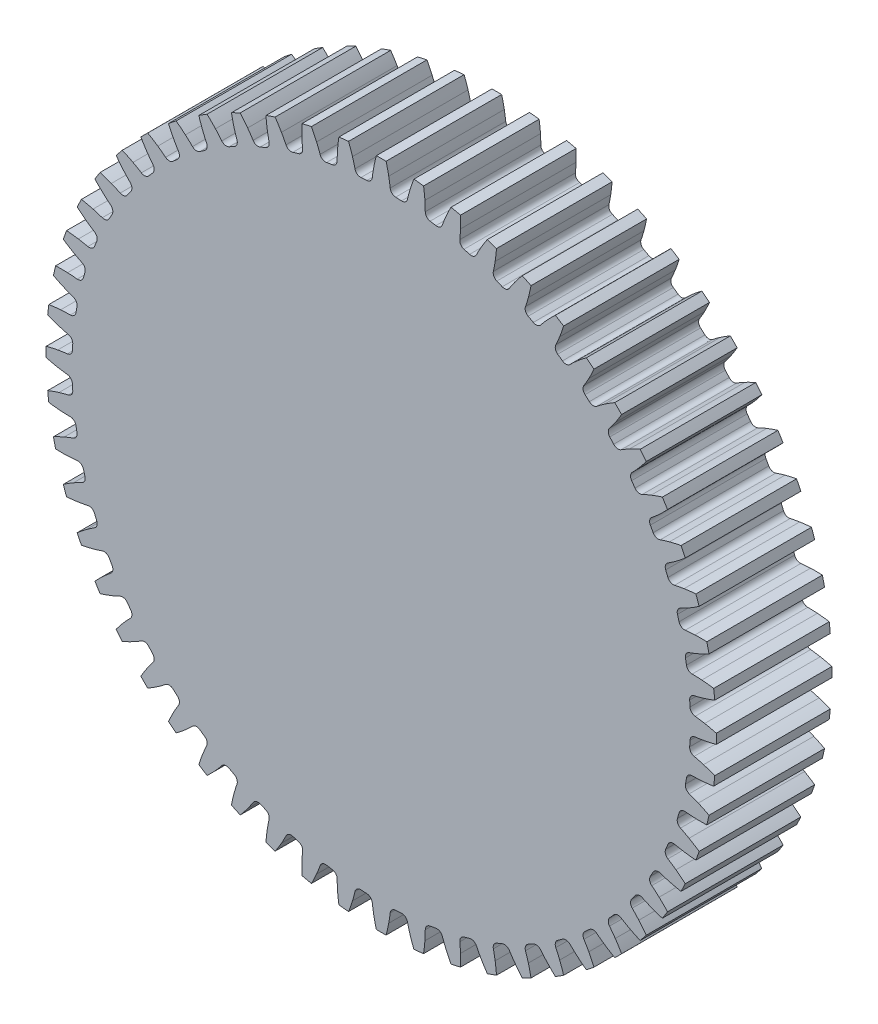
from build123d import *

# Parameters (mm, degrees)
BOSS_EXTRUDE1_DEPTH = 50


with BuildPart() as part:
    # Sketch1 → Boss-Extrude1 (new body)
    with BuildSketch(Plane.XY):
        with BuildLine():
            ThreePointArc((-6.237316061, 133.604484911), (-7.499422318, 133.539586509), (-8.760859031, 133.462765778))
            ThreePointArc((-8.760859031, 133.462765778), (-10.418270981, 133.952655771), (-11.361832531, 135.400653761))
            ThreePointArc((-11.361832531, 135.400653761), (-11.864955386, 137.433138507), (-12.441237743, 139.446102862))
            ThreePointArc((-12.441237743, 139.446102862), (-13.244705793, 141.894408075), (-14.146350673, 144.308283763))
            ThreePointArc((-14.146350673, 144.308283763), (-16.234849035, 144.088270435), (-18.319941954, 143.838032963))
            ThreePointArc((-18.319941954, 143.838032963), (-18.661842842, 141.284043318), (-18.900367108, 138.718333767))
            ThreePointArc((-18.900367108, 138.718333767), (-19.014274155, 136.627603743), (-19.052512266, 134.534122266))
            ThreePointArc((-19.052512266, 134.534122266), (-19.650206892, 132.912466411), (-21.157053285, 132.066050128))
            ThreePointArc((-21.157053285, 132.066050128), (-22.403957367, 131.860248727), (-23.648861238, 131.642674928))
            ThreePointArc((-23.648861238, 131.642674928), (-25.350702006, 131.943913335), (-26.450454975, 133.277161243))
            ThreePointArc((-26.450454975, 133.277161243), (-27.177980389, 135.240534265), (-27.976019703, 137.17631837))
            ThreePointArc((-27.976019703, 137.17631837), (-29.048558925, 139.519269275), (-30.214802778, 141.817014822))
            ThreePointArc((-30.214802778, 141.817014822), (-32.265535424, 141.364547266), (-34.309500009, 140.8824269))
            ThreePointArc((-34.309500009, 140.8824269), (-34.363294983, 138.306215452), (-34.313051132, 135.729932299))
            ThreePointArc((-34.313051132, 135.729932299), (-34.192154464, 133.639594804), (-33.995756585, 131.554995388))
            ThreePointArc((-33.995756585, 131.554995388), (-34.408125185, 129.8766156), (-35.810728288, 128.866808137))
            ThreePointArc((-35.810728288, 128.866808137), (-37.026749653, 128.52269181), (-38.239465294, 128.16710106))
            ThreePointArc((-38.239465294, 128.16710106), (-39.964333244, 128.275899633), (-41.206447601, 129.477631093))
            ThreePointArc((-41.206447601, 129.477631093), (-42.149226519, 131.347201836), (-43.158986983, 133.181462083))
            ThreePointArc((-43.158986983, 133.181462083), (-44.487109575, 135.389594712), (-45.903286207, 137.542314636))
            ThreePointArc((-45.903286207, 137.542314636), (-47.890463983, 136.863082895), (-49.867596194, 136.155142576))
            ThreePointArc((-49.867596194, 136.155142576), (-49.632608751, 133.589106678), (-49.29422863, 131.03464818))
            ThreePointArc((-49.29422863, 131.03464818), (-48.940048593, 128.97099042), (-48.511484541, 126.921488114))
            ThreePointArc((-48.511484541, 126.921488114), (-48.73334134, 125.207490991), (-50.014062605, 124.046991264))
            ThreePointArc((-50.014062605, 124.046991264), (-51.183909079, 123.568887473), (-52.349185886, 123.079751532))
            ThreePointArc((-52.349185886, 123.079751532), (-54.075389804, 122.994742066), (-55.44424524, 124.049844608))
            ThreePointArc((-55.44424524, 124.049844608), (-56.590421671, 125.802102134), (-57.799204961, 127.511771637))
            ThreePointArc((-57.799204961, 127.511771637), (-59.366209009, 129.557317441), (-61.014509178, 131.537940039))
            ThreePointArc((-61.014509178, 131.537940039), (-62.913142172, 130.640485846), (-64.798578423, 129.715628335))
            ThreePointArc((-64.798578423, 129.715628335), (-64.277763667, 127.192037379), (-63.655502602, 124.691527332))
            ThreePointArc((-63.655502602, 124.691527332), (-63.072493214, 122.680501002), (-62.417152431, 120.691869485))
            ThreePointArc((-62.417152431, 120.691869485), (-62.445707451, 118.963809536), (-63.588441066, 117.667211502))
            ThreePointArc((-63.588441066, 117.667211502), (-64.69740115, 117.06113268), (-65.800585092, 116.444602715))
            ThreePointArc((-65.800585092, 116.444602715), (-67.506416962, 116.166854254), (-68.984799325, 117.062059351))
            ThreePointArc((-68.984799325, 117.062059351), (-70.319959436, 118.674968006), (-71.7125644, 120.238546678))
            ThreePointArc((-71.7125644, 120.238546678), (-73.49874392, 122.095781732), (-75.358439295, 123.879399526))
            ThreePointArc((-75.358439295, 123.879399526), (-77.144651095, 122.775008888), (-78.914680932, 121.644864805))
            ThreePointArc((-78.914680932, 121.644864805), (-78.114588411, 119.19545441), (-77.216271695, 116.78033818))
            ThreePointArc((-77.216271695, 116.78033818), (-76.411764638, 114.847233102), (-75.537888414, 112.944480571))
            ThreePointArc((-75.537888414, 112.944480571), (-75.37278256, 111.224089152), (-76.363157986, 109.807698284))
            ThreePointArc((-76.363157986, 109.807698284), (-77.397285864, 109.081266223), (-78.424503762, 108.345095457))
            ThreePointArc((-78.424503762, 108.345095457), (-80.088511758, 107.878100849), (-81.657829533, 108.602150777))
            ThreePointArc((-81.657829533, 108.602150777), (-83.16518291, 110.055427298), (-84.724096733, 111.45325223))
            ThreePointArc((-84.724096733, 111.45325223), (-86.706989481, 113.098820726), (-88.754693314, 114.663003688))
            ThreePointArc((-88.754693314, 114.663003688), (-90.40602127, 113.365564958), (-92.038385541, 112.04434652))
            ThreePointArc((-92.038385541, 112.04434652), (-90.969076881, 109.699919444), (-89.806001369, 107.400568518))
            ThreePointArc((-89.806001369, 107.400568518), (-88.790113786, 105.56969461), (-87.708691623, 103.776749281))
            ThreePointArc((-87.708691623, 103.776749281), (-87.352001195, 102.085661313), (-88.177563887, 100.567289547))
            ThreePointArc((-88.177563887, 100.567289547), (-89.123854801, 99.729639553), (-90.062188794, 98.883085761))
            ThreePointArc((-90.062188794, 98.883085761), (-91.663447051, 98.232717733), (-93.303965156, 98.776507144))
            ThreePointArc((-93.303965156, 98.776507144), (-94.964555955, 100.051875737), (-96.670174392, 101.26636847))
            ThreePointArc((-96.670174392, 101.26636847), (-98.824844341, 102.679576429), (-101.034805568, 104.004654049))
            ThreePointArc((-101.034805568, 104.004654049), (-102.530483272, 102.530483272), (-104.004654049, 101.034805568))
            ThreePointArc((-104.004654049, 101.034805568), (-102.679576429, 98.824844341), (-101.26636847, 96.670174392))
            ThreePointArc((-101.26636847, 96.670174392), (-100.051875737, 94.964555955), (-98.776507144, 93.303965156))
            ThreePointArc((-98.776507144, 93.303965156), (-98.232717733, 91.663447051), (-98.883085761, 90.062188794))
            ThreePointArc((-98.883085761, 90.062188794), (-99.729639553, 89.123854801), (-100.567289547, 88.177563887))
            ThreePointArc((-100.567289547, 88.177563887), (-102.085661313, 87.352001195), (-103.776749281, 87.708691623))
            ThreePointArc((-103.776749281, 87.708691623), (-105.56969461, 88.790113786), (-107.400568518, 89.806001369))
            ThreePointArc((-107.400568518, 89.806001369), (-109.699919444, 90.969076881), (-112.04434652, 92.038385541))
            ThreePointArc((-112.04434652, 92.038385541), (-113.365564958, 90.40602127), (-114.663003688, 88.754693314))
            ThreePointArc((-114.663003688, 88.754693314), (-113.098820726, 86.706989481), (-111.45325223, 84.724096733))
            ThreePointArc((-111.45325223, 84.724096733), (-110.055427298, 83.16518291), (-108.602150777, 81.657829533))
            ThreePointArc((-108.602150777, 81.657829533), (-107.878100849, 80.088511758), (-108.345095457, 78.424503762))
            ThreePointArc((-108.345095457, 78.424503762), (-109.081266223, 77.397285864), (-109.807698284, 76.363157986))
            ThreePointArc((-109.807698284, 76.363157986), (-111.224089152, 75.37278256), (-112.944480571, 75.537888414))
            ThreePointArc((-112.944480571, 75.537888414), (-114.847233102, 76.411764638), (-116.78033818, 77.216271695))
            ThreePointArc((-116.78033818, 77.216271695), (-119.19545441, 78.114588411), (-121.644864805, 78.914680932))
            ThreePointArc((-121.644864805, 78.914680932), (-122.775008888, 77.144651095), (-123.879399526, 75.358439295))
            ThreePointArc((-123.879399526, 75.358439295), (-122.095781732, 73.49874392), (-120.238546678, 71.7125644))
            ThreePointArc((-120.238546678, 71.7125644), (-118.674968006, 70.319959436), (-117.062059351, 68.984799325))
            ThreePointArc((-117.062059351, 68.984799325), (-116.166854254, 67.506416962), (-116.444602715, 65.800585092))
            ThreePointArc((-116.444602715, 65.800585092), (-117.06113268, 64.69740115), (-117.667211502, 63.588441066))
            ThreePointArc((-117.667211502, 63.588441066), (-118.963809536, 62.445707451), (-120.691869485, 62.417152431))
            ThreePointArc((-120.691869485, 62.417152431), (-122.680501001, 63.072493214), (-124.691527332, 63.655502602))
            ThreePointArc((-124.691527332, 63.655502602), (-127.192037379, 64.277763667), (-129.715628335, 64.798578423))
            ThreePointArc((-129.715628335, 64.798578423), (-130.640485846, 62.913142172), (-131.537940039, 61.014509178))
            ThreePointArc((-131.537940039, 61.014509178), (-129.557317441, 59.366209009), (-127.511771637, 57.799204961))
            ThreePointArc((-127.511771637, 57.799204961), (-125.802102134, 56.590421671), (-124.049844608, 55.44424524))
            ThreePointArc((-124.049844608, 55.44424524), (-122.994742066, 54.075389804), (-123.079751532, 52.349185886))
            ThreePointArc((-123.079751532, 52.349185886), (-123.568887473, 51.183909079), (-124.046991264, 50.014062605))
            ThreePointArc((-124.046991264, 50.014062605), (-125.207490991, 48.73334134), (-126.921488114, 48.511484541))
            ThreePointArc((-126.921488114, 48.511484541), (-128.97099042, 48.940048593), (-131.03464818, 49.29422863))
            ThreePointArc((-131.03464818, 49.29422863), (-133.589106678, 49.632608751), (-136.155142576, 49.867596194))
            ThreePointArc((-136.155142576, 49.867596194), (-136.863082895, 47.890463984), (-137.542314636, 45.903286207))
            ThreePointArc((-137.542314636, 45.903286207), (-135.389594712, 44.487109575), (-133.181462083, 43.158986983))
            ThreePointArc((-133.181462083, 43.158986983), (-131.347201836, 42.149226519), (-129.477631093, 41.206447601))
            ThreePointArc((-129.477631093, 41.206447601), (-128.275899633, 39.964333244), (-128.16710106, 38.239465294))
            ThreePointArc((-128.16710106, 38.239465294), (-128.52269181, 37.026749653), (-128.866808137, 35.810728288))
            ThreePointArc((-128.866808137, 35.810728288), (-129.8766156, 34.408125185), (-131.554995388, 33.995756585))
            ThreePointArc((-131.554995388, 33.995756585), (-133.639594804, 34.192154464), (-135.729932299, 34.313051132))
            ThreePointArc((-135.729932299, 34.313051132), (-138.306215452, 34.363294983), (-140.8824269, 34.309500009))
            ThreePointArc((-140.8824269, 34.309500009), (-141.364547266, 32.265535424), (-141.817014822, 30.214802778))
            ThreePointArc((-141.817014822, 30.214802778), (-139.519269275, 29.048558925), (-137.17631837, 27.976019703))
            ThreePointArc((-137.17631837, 27.976019703), (-135.240534265, 27.177980389), (-133.277161243, 26.450454975))
            ThreePointArc((-133.277161243, 26.450454975), (-131.943913335, 25.350702006), (-131.642674928, 23.648861238))
            ThreePointArc((-131.642674928, 23.648861238), (-131.860248727, 22.403957367), (-132.066050128, 21.157053285))
            ThreePointArc((-132.066050128, 21.157053285), (-132.912466411, 19.650206892), (-134.534122266, 19.052512266))
            ThreePointArc((-134.534122266, 19.052512266), (-136.627603743, 19.014274155), (-138.718333767, 18.900367108))
            ThreePointArc((-138.718333767, 18.900367108), (-141.284043318, 18.661842842), (-143.838032963, 18.319941954))
            ThreePointArc((-143.838032963, 18.319941954), (-144.088270435, 16.234849035), (-144.308283763, 14.146350673))
            ThreePointArc((-144.308283763, 14.146350673), (-141.894408075, 13.244705793), (-139.446102862, 12.441237743))
            ThreePointArc((-139.446102862, 12.441237743), (-137.433138507, 11.864955386), (-135.400653761, 11.361832531))
            ThreePointArc((-135.400653761, 11.361832531), (-133.952655771, 10.418270981), (-133.462765778, 8.760859031))
            ThreePointArc((-133.462765778, 8.760859031), (-133.539586509, 7.499422318), (-133.604484911, 6.237316061))
            ThreePointArc((-133.604484911, 6.237316061), (-134.27686584, 4.645175846), (-135.821404497, 3.86967155))
            ThreePointArc((-135.821404497, 3.86967155), (-137.897441292, 3.597278316), (-139.962271702, 3.25))
            ThreePointArc((-139.962271702, 3.25), (-142.485142365, 2.725707199), (-144.984792306, 2.1))
            ThreePointArc((-144.984792306, 2.1), (-145, 0), (-144.984792306, -2.1))
            ThreePointArc((-144.984792306, -2.1), (-142.485142365, -2.725707199), (-139.962271702, -3.25))
            ThreePointArc((-139.962271702, -3.25), (-137.897441292, -3.597278316), (-135.821404497, -3.86967155))
            ThreePointArc((-135.821404497, -3.86967155), (-134.27686584, -4.645175846), (-133.604484911, -6.237316061))
            ThreePointArc((-133.604484911, -6.237316061), (-133.539586509, -7.499422318), (-133.462765778, -8.760859031))
            ThreePointArc((-133.462765778, -8.760859031), (-133.952655771, -10.418270981), (-135.400653761, -11.361832531))
            ThreePointArc((-135.400653761, -11.361832531), (-137.433138507, -11.864955386), (-139.446102862, -12.441237743))
            ThreePointArc((-139.446102862, -12.441237743), (-141.894408075, -13.244705793), (-144.308283763, -14.146350673))
            ThreePointArc((-144.308283763, -14.146350673), (-144.088270435, -16.234849035), (-143.838032963, -18.319941954))
            ThreePointArc((-143.838032963, -18.319941954), (-141.284043318, -18.661842842), (-138.718333767, -18.900367108))
            ThreePointArc((-138.718333767, -18.900367108), (-136.627603743, -19.014274155), (-134.534122266, -19.052512266))
            ThreePointArc((-134.534122266, -19.052512266), (-132.912466411, -19.650206892), (-132.066050128, -21.157053285))
            ThreePointArc((-132.066050128, -21.157053285), (-131.860248727, -22.403957367), (-131.642674928, -23.648861238))
            ThreePointArc((-131.642674928, -23.648861238), (-131.943913335, -25.350702006), (-133.277161243, -26.450454975))
            ThreePointArc((-133.277161243, -26.450454975), (-135.240534265, -27.177980389), (-137.17631837, -27.976019703))
            ThreePointArc((-137.17631837, -27.976019703), (-139.519269275, -29.048558925), (-141.817014822, -30.214802778))
            ThreePointArc((-141.817014822, -30.214802778), (-141.364547266, -32.265535424), (-140.8824269, -34.309500009))
            ThreePointArc((-140.8824269, -34.309500009), (-138.306215452, -34.363294983), (-135.729932299, -34.313051132))
            ThreePointArc((-135.729932299, -34.313051132), (-133.639594804, -34.192154464), (-131.554995388, -33.995756585))
            ThreePointArc((-131.554995388, -33.995756585), (-129.8766156, -34.408125185), (-128.866808137, -35.810728288))
            ThreePointArc((-128.866808137, -35.810728288), (-128.52269181, -37.026749653), (-128.16710106, -38.239465294))
            ThreePointArc((-128.16710106, -38.239465294), (-128.275899633, -39.964333244), (-129.477631093, -41.206447601))
            ThreePointArc((-129.477631093, -41.206447601), (-131.347201836, -42.149226519), (-133.181462083, -43.158986983))
            ThreePointArc((-133.181462083, -43.158986983), (-135.389594712, -44.487109575), (-137.542314636, -45.903286207))
            ThreePointArc((-137.542314636, -45.903286207), (-136.863082895, -47.890463983), (-136.155142576, -49.867596194))
            ThreePointArc((-136.155142576, -49.867596194), (-133.589106678, -49.632608751), (-131.03464818, -49.29422863))
            ThreePointArc((-131.03464818, -49.29422863), (-128.97099042, -48.940048593), (-126.921488114, -48.511484541))
            ThreePointArc((-126.921488114, -48.511484541), (-125.207490991, -48.73334134), (-124.046991264, -50.014062605))
            ThreePointArc((-124.046991264, -50.014062605), (-123.568887473, -51.183909079), (-123.079751532, -52.349185886))
            ThreePointArc((-123.079751532, -52.349185886), (-122.994742066, -54.075389804), (-124.049844608, -55.44424524))
            ThreePointArc((-124.049844608, -55.44424524), (-125.802102134, -56.590421671), (-127.511771637, -57.799204961))
            ThreePointArc((-127.511771637, -57.799204961), (-129.557317441, -59.366209009), (-131.537940039, -61.014509178))
            ThreePointArc((-131.537940039, -61.014509178), (-130.640485846, -62.913142172), (-129.715628335, -64.798578423))
            ThreePointArc((-129.715628335, -64.798578423), (-127.192037379, -64.277763667), (-124.691527332, -63.655502602))
            ThreePointArc((-124.691527332, -63.655502602), (-122.680501002, -63.072493214), (-120.691869485, -62.417152431))
            ThreePointArc((-120.691869485, -62.417152431), (-118.963809536, -62.445707451), (-117.667211502, -63.588441066))
            ThreePointArc((-117.667211502, -63.588441066), (-117.06113268, -64.69740115), (-116.444602715, -65.800585092))
            ThreePointArc((-116.444602715, -65.800585092), (-116.166854254, -67.506416962), (-117.062059351, -68.984799325))
            ThreePointArc((-117.062059351, -68.984799325), (-118.674968006, -70.319959436), (-120.238546678, -71.7125644))
            ThreePointArc((-120.238546678, -71.7125644), (-122.095781732, -73.49874392), (-123.879399526, -75.358439295))
            ThreePointArc((-123.879399526, -75.358439295), (-122.775008888, -77.144651095), (-121.644864805, -78.914680932))
            ThreePointArc((-121.644864805, -78.914680932), (-119.19545441, -78.114588411), (-116.78033818, -77.216271695))
            ThreePointArc((-116.78033818, -77.216271695), (-114.847233102, -76.411764638), (-112.944480571, -75.537888414))
            ThreePointArc((-112.944480571, -75.537888414), (-111.224089152, -75.37278256), (-109.807698284, -76.363157986))
            ThreePointArc((-109.807698284, -76.363157986), (-109.081266223, -77.397285864), (-108.345095457, -78.424503762))
            ThreePointArc((-108.345095457, -78.424503762), (-107.878100849, -80.088511758), (-108.602150777, -81.657829533))
            ThreePointArc((-108.602150777, -81.657829533), (-110.055427298, -83.16518291), (-111.45325223, -84.724096733))
            ThreePointArc((-111.45325223, -84.724096733), (-113.098820726, -86.706989481), (-114.663003688, -88.754693314))
            ThreePointArc((-114.663003688, -88.754693314), (-113.365564958, -90.40602127), (-112.04434652, -92.038385541))
            ThreePointArc((-112.04434652, -92.038385541), (-109.699919444, -90.969076881), (-107.400568518, -89.806001369))
            ThreePointArc((-107.400568518, -89.806001369), (-105.56969461, -88.790113786), (-103.776749281, -87.708691623))
            ThreePointArc((-103.776749281, -87.708691623), (-102.085661313, -87.352001195), (-100.567289547, -88.177563887))
            ThreePointArc((-100.567289547, -88.177563887), (-99.729639553, -89.123854801), (-98.883085761, -90.062188794))
            ThreePointArc((-98.883085761, -90.062188794), (-98.232717733, -91.663447051), (-98.776507144, -93.303965156))
            ThreePointArc((-98.776507144, -93.303965156), (-100.051875737, -94.964555955), (-101.26636847, -96.670174392))
            ThreePointArc((-101.26636847, -96.670174392), (-102.679576429, -98.824844341), (-104.004654049, -101.034805568))
            ThreePointArc((-104.004654049, -101.034805568), (-102.530483272, -102.530483272), (-101.034805568, -104.004654049))
            ThreePointArc((-101.034805568, -104.004654049), (-98.824844341, -102.679576429), (-96.670174392, -101.26636847))
            ThreePointArc((-96.670174392, -101.26636847), (-94.964555955, -100.051875737), (-93.303965156, -98.776507144))
            ThreePointArc((-93.303965156, -98.776507144), (-91.663447051, -98.232717733), (-90.062188794, -98.883085761))
            ThreePointArc((-90.062188794, -98.883085761), (-89.123854801, -99.729639553), (-88.177563887, -100.567289547))
            ThreePointArc((-88.177563887, -100.567289547), (-87.352001195, -102.085661313), (-87.708691623, -103.776749281))
            ThreePointArc((-87.708691623, -103.776749281), (-88.790113786, -105.56969461), (-89.806001369, -107.400568518))
            ThreePointArc((-89.806001369, -107.400568518), (-90.969076881, -109.699919444), (-92.038385541, -112.04434652))
            ThreePointArc((-92.038385541, -112.04434652), (-90.40602127, -113.365564958), (-88.754693314, -114.663003688))
            ThreePointArc((-88.754693314, -114.663003688), (-86.706989481, -113.098820726), (-84.724096733, -111.45325223))
            ThreePointArc((-84.724096733, -111.45325223), (-83.16518291, -110.055427298), (-81.657829533, -108.602150777))
            ThreePointArc((-81.657829533, -108.602150777), (-80.088511758, -107.878100849), (-78.424503762, -108.345095457))
            ThreePointArc((-78.424503762, -108.345095457), (-77.397285864, -109.081266223), (-76.363157986, -109.807698284))
            ThreePointArc((-76.363157986, -109.807698284), (-75.37278256, -111.224089152), (-75.537888414, -112.944480571))
            ThreePointArc((-75.537888414, -112.944480571), (-76.411764638, -114.847233102), (-77.216271695, -116.78033818))
            ThreePointArc((-77.216271695, -116.78033818), (-78.114588411, -119.19545441), (-78.914680932, -121.644864805))
            ThreePointArc((-78.914680932, -121.644864805), (-77.144651095, -122.775008888), (-75.358439295, -123.879399526))
            ThreePointArc((-75.358439295, -123.879399526), (-73.49874392, -122.095781732), (-71.7125644, -120.238546678))
            ThreePointArc((-71.7125644, -120.238546678), (-70.319959436, -118.674968006), (-68.984799325, -117.062059351))
            ThreePointArc((-68.984799325, -117.062059351), (-67.506416962, -116.166854254), (-65.800585092, -116.444602715))
            ThreePointArc((-65.800585092, -116.444602715), (-64.69740115, -117.06113268), (-63.588441066, -117.667211502))
            ThreePointArc((-63.588441066, -117.667211502), (-62.445707451, -118.963809536), (-62.417152431, -120.691869485))
            ThreePointArc((-62.417152431, -120.691869485), (-63.072493214, -122.680501002), (-63.655502602, -124.691527332))
            ThreePointArc((-63.655502602, -124.691527332), (-64.277763667, -127.192037379), (-64.798578423, -129.715628335))
            ThreePointArc((-64.798578423, -129.715628335), (-62.913142172, -130.640485846), (-61.014509178, -131.537940039))
            ThreePointArc((-61.014509178, -131.537940039), (-59.366209009, -129.557317441), (-57.799204961, -127.511771637))
            ThreePointArc((-57.799204961, -127.511771637), (-56.590421671, -125.802102134), (-55.44424524, -124.049844608))
            ThreePointArc((-55.44424524, -124.049844608), (-54.075389804, -122.994742066), (-52.349185886, -123.079751532))
            ThreePointArc((-52.349185886, -123.079751532), (-51.183909079, -123.568887473), (-50.014062605, -124.046991264))
            ThreePointArc((-50.014062605, -124.046991264), (-48.73334134, -125.207490991), (-48.511484541, -126.921488114))
            ThreePointArc((-48.511484541, -126.921488114), (-48.940048593, -128.97099042), (-49.29422863, -131.03464818))
            ThreePointArc((-49.29422863, -131.03464818), (-49.632608751, -133.589106678), (-49.867596194, -136.155142576))
            ThreePointArc((-49.867596194, -136.155142576), (-47.890463984, -136.863082895), (-45.903286207, -137.542314636))
            ThreePointArc((-45.903286207, -137.542314636), (-44.487109575, -135.389594712), (-43.158986983, -133.181462083))
            ThreePointArc((-43.158986983, -133.181462083), (-42.149226519, -131.347201836), (-41.206447601, -129.477631093))
            ThreePointArc((-41.206447601, -129.477631093), (-39.964333244, -128.275899633), (-38.239465294, -128.16710106))
            ThreePointArc((-38.239465294, -128.16710106), (-37.026749653, -128.52269181), (-35.810728288, -128.866808137))
            ThreePointArc((-35.810728288, -128.866808137), (-34.408125185, -129.8766156), (-33.995756585, -131.554995388))
            ThreePointArc((-33.995756585, -131.554995388), (-34.192154464, -133.639594804), (-34.313051132, -135.729932299))
            ThreePointArc((-34.313051132, -135.729932299), (-34.363294983, -138.306215452), (-34.309500009, -140.8824269))
            ThreePointArc((-34.309500009, -140.8824269), (-32.265535424, -141.364547266), (-30.214802778, -141.817014822))
            ThreePointArc((-30.214802778, -141.817014822), (-29.048558925, -139.519269275), (-27.976019703, -137.17631837))
            ThreePointArc((-27.976019703, -137.17631837), (-27.177980389, -135.240534265), (-26.450454975, -133.277161243))
            ThreePointArc((-26.450454975, -133.277161243), (-25.350702006, -131.943913335), (-23.648861238, -131.642674928))
            ThreePointArc((-23.648861238, -131.642674928), (-22.403957367, -131.860248727), (-21.157053285, -132.066050128))
            ThreePointArc((-21.157053285, -132.066050128), (-19.650206892, -132.912466411), (-19.052512266, -134.534122266))
            ThreePointArc((-19.052512266, -134.534122266), (-19.014274155, -136.627603743), (-18.900367108, -138.718333767))
            ThreePointArc((-18.900367108, -138.718333767), (-18.661842842, -141.284043318), (-18.319941954, -143.838032963))
            ThreePointArc((-18.319941954, -143.838032963), (-16.234849035, -144.088270435), (-14.146350673, -144.308283763))
            ThreePointArc((-14.146350673, -144.308283763), (-13.244705793, -141.894408075), (-12.441237743, -139.446102862))
            ThreePointArc((-12.441237743, -139.446102862), (-11.864955386, -137.433138507), (-11.361832531, -135.400653761))
            ThreePointArc((-11.361832531, -135.400653761), (-10.418270981, -133.952655771), (-8.760859031, -133.462765778))
            ThreePointArc((-8.760859031, -133.462765778), (-7.499422318, -133.539586509), (-6.237316061, -133.604484911))
            ThreePointArc((-6.237316061, -133.604484911), (-4.645175846, -134.27686584), (-3.86967155, -135.821404497))
            ThreePointArc((-3.86967155, -135.821404497), (-3.597278316, -137.897441292), (-3.25, -139.962271702))
            ThreePointArc((-3.25, -139.962271702), (-2.725707199, -142.485142365), (-2.1, -144.984792306))
            ThreePointArc((-2.1, -144.984792306), (0, -145), (2.1, -144.984792306))
            ThreePointArc((2.1, -144.984792306), (2.725707199, -142.485142365), (3.25, -139.962271702))
            ThreePointArc((3.25, -139.962271702), (3.597278316, -137.897441292), (3.86967155, -135.821404497))
            ThreePointArc((3.86967155, -135.821404497), (4.645175846, -134.27686584), (6.237316061, -133.604484911))
            ThreePointArc((6.237316061, -133.604484911), (7.499422318, -133.539586509), (8.760859031, -133.462765778))
            ThreePointArc((8.760859031, -133.462765778), (10.418270981, -133.952655771), (11.361832531, -135.400653761))
            ThreePointArc((11.361832531, -135.400653761), (11.864955386, -137.433138507), (12.441237743, -139.446102862))
            ThreePointArc((12.441237743, -139.446102862), (13.244705793, -141.894408075), (14.146350673, -144.308283763))
            ThreePointArc((14.146350673, -144.308283763), (16.234849035, -144.088270435), (18.319941954, -143.838032963))
            ThreePointArc((18.319941954, -143.838032963), (18.661842842, -141.284043318), (18.900367108, -138.718333767))
            ThreePointArc((18.900367108, -138.718333767), (19.014274155, -136.627603743), (19.052512266, -134.534122266))
            ThreePointArc((19.052512266, -134.534122266), (19.650206892, -132.912466411), (21.157053285, -132.066050128))
            ThreePointArc((21.157053285, -132.066050128), (22.403957367, -131.860248727), (23.648861238, -131.642674928))
            ThreePointArc((23.648861238, -131.642674928), (25.350702006, -131.943913335), (26.450454975, -133.277161243))
            ThreePointArc((26.450454975, -133.277161243), (27.177980389, -135.240534265), (27.976019703, -137.17631837))
            ThreePointArc((27.976019703, -137.17631837), (29.048558925, -139.519269275), (30.214802778, -141.817014822))
            ThreePointArc((30.214802778, -141.817014822), (32.265535424, -141.364547266), (34.309500009, -140.8824269))
            ThreePointArc((34.309500009, -140.8824269), (34.363294983, -138.306215452), (34.313051132, -135.729932299))
            ThreePointArc((34.313051132, -135.729932299), (34.192154464, -133.639594804), (33.995756585, -131.554995388))
            ThreePointArc((33.995756585, -131.554995388), (34.408125185, -129.8766156), (35.810728288, -128.866808137))
            ThreePointArc((35.810728288, -128.866808137), (37.026749653, -128.52269181), (38.239465294, -128.16710106))
            ThreePointArc((38.239465294, -128.16710106), (39.964333244, -128.275899633), (41.206447601, -129.477631093))
            ThreePointArc((41.206447601, -129.477631093), (42.149226519, -131.347201836), (43.158986983, -133.181462083))
            ThreePointArc((43.158986983, -133.181462083), (44.487109575, -135.389594712), (45.903286207, -137.542314636))
            ThreePointArc((45.903286207, -137.542314636), (47.890463983, -136.863082895), (49.867596194, -136.155142576))
            ThreePointArc((49.867596194, -136.155142576), (49.632608751, -133.589106678), (49.29422863, -131.03464818))
            ThreePointArc((49.29422863, -131.03464818), (48.940048593, -128.97099042), (48.511484541, -126.921488114))
            ThreePointArc((48.511484541, -126.921488114), (48.73334134, -125.207490991), (50.014062605, -124.046991264))
            ThreePointArc((50.014062605, -124.046991264), (51.183909079, -123.568887473), (52.349185886, -123.079751532))
            ThreePointArc((52.349185886, -123.079751532), (54.075389804, -122.994742066), (55.44424524, -124.049844608))
            ThreePointArc((55.44424524, -124.049844608), (56.590421671, -125.802102134), (57.799204961, -127.511771637))
            ThreePointArc((57.799204961, -127.511771637), (59.366209009, -129.557317441), (61.014509178, -131.537940039))
            ThreePointArc((61.014509178, -131.537940039), (62.913142172, -130.640485846), (64.798578423, -129.715628335))
            ThreePointArc((64.798578423, -129.715628335), (64.277763667, -127.192037379), (63.655502602, -124.691527332))
            ThreePointArc((63.655502602, -124.691527332), (63.072493214, -122.680501002), (62.417152431, -120.691869485))
            ThreePointArc((62.417152431, -120.691869485), (62.445707451, -118.963809536), (63.588441066, -117.667211502))
            ThreePointArc((63.588441066, -117.667211502), (64.69740115, -117.06113268), (65.800585092, -116.444602715))
            ThreePointArc((65.800585092, -116.444602715), (67.506416962, -116.166854254), (68.984799325, -117.062059351))
            ThreePointArc((68.984799325, -117.062059351), (70.319959436, -118.674968006), (71.7125644, -120.238546678))
            ThreePointArc((71.7125644, -120.238546678), (73.49874392, -122.095781732), (75.358439295, -123.879399526))
            ThreePointArc((75.358439295, -123.879399526), (77.144651095, -122.775008888), (78.914680932, -121.644864805))
            ThreePointArc((78.914680932, -121.644864805), (78.114588411, -119.19545441), (77.216271695, -116.78033818))
            ThreePointArc((77.216271695, -116.78033818), (76.411764638, -114.847233102), (75.537888414, -112.944480571))
            ThreePointArc((75.537888414, -112.944480571), (75.37278256, -111.224089152), (76.363157986, -109.807698284))
            ThreePointArc((76.363157986, -109.807698284), (77.397285864, -109.081266223), (78.424503762, -108.345095457))
            ThreePointArc((78.424503762, -108.345095457), (80.088511758, -107.878100849), (81.657829533, -108.602150777))
            ThreePointArc((81.657829533, -108.602150777), (83.16518291, -110.055427298), (84.724096733, -111.45325223))
            ThreePointArc((84.724096733, -111.45325223), (86.706989481, -113.098820726), (88.754693314, -114.663003688))
            ThreePointArc((88.754693314, -114.663003688), (90.40602127, -113.365564958), (92.038385541, -112.04434652))
            ThreePointArc((92.038385541, -112.04434652), (90.969076881, -109.699919444), (89.806001369, -107.400568518))
            ThreePointArc((89.806001369, -107.400568518), (88.790113786, -105.56969461), (87.708691623, -103.776749281))
            ThreePointArc((87.708691623, -103.776749281), (87.352001195, -102.085661313), (88.177563887, -100.567289547))
            ThreePointArc((88.177563887, -100.567289547), (89.123854801, -99.729639553), (90.062188794, -98.883085761))
            ThreePointArc((90.062188794, -98.883085761), (91.663447051, -98.232717733), (93.303965156, -98.776507144))
            ThreePointArc((93.303965156, -98.776507144), (94.964555955, -100.051875737), (96.670174392, -101.26636847))
            ThreePointArc((96.670174392, -101.26636847), (98.824844341, -102.679576429), (101.034805568, -104.004654049))
            ThreePointArc((101.034805568, -104.004654049), (102.530483272, -102.530483272), (104.004654049, -101.034805568))
            ThreePointArc((104.004654049, -101.034805568), (102.679576429, -98.824844341), (101.26636847, -96.670174392))
            ThreePointArc((101.26636847, -96.670174392), (100.051875737, -94.964555955), (98.776507144, -93.303965156))
            ThreePointArc((98.776507144, -93.303965156), (98.232717733, -91.663447051), (98.883085761, -90.062188794))
            ThreePointArc((98.883085761, -90.062188794), (99.729639553, -89.123854801), (100.567289547, -88.177563887))
            ThreePointArc((100.567289547, -88.177563887), (102.085661313, -87.352001195), (103.776749281, -87.708691623))
            ThreePointArc((103.776749281, -87.708691623), (105.56969461, -88.790113786), (107.400568518, -89.806001369))
            ThreePointArc((107.400568518, -89.806001369), (109.699919444, -90.969076881), (112.04434652, -92.038385541))
            ThreePointArc((112.04434652, -92.038385541), (113.365564958, -90.40602127), (114.663003688, -88.754693314))
            ThreePointArc((114.663003688, -88.754693314), (113.098820726, -86.706989481), (111.45325223, -84.724096733))
            ThreePointArc((111.45325223, -84.724096733), (110.055427298, -83.16518291), (108.602150777, -81.657829533))
            ThreePointArc((108.602150777, -81.657829533), (107.878100849, -80.088511758), (108.345095457, -78.424503762))
            ThreePointArc((108.345095457, -78.424503762), (109.081266223, -77.397285864), (109.807698284, -76.363157986))
            ThreePointArc((109.807698284, -76.363157986), (111.224089152, -75.37278256), (112.944480571, -75.537888414))
            ThreePointArc((112.944480571, -75.537888414), (114.847233102, -76.411764638), (116.78033818, -77.216271695))
            ThreePointArc((116.78033818, -77.216271695), (119.19545441, -78.114588411), (121.644864805, -78.914680932))
            ThreePointArc((121.644864805, -78.914680932), (122.775008888, -77.144651095), (123.879399526, -75.358439295))
            ThreePointArc((123.879399526, -75.358439295), (122.095781732, -73.49874392), (120.238546678, -71.7125644))
            ThreePointArc((120.238546678, -71.7125644), (118.674968006, -70.319959436), (117.062059351, -68.984799325))
            ThreePointArc((117.062059351, -68.984799325), (116.166854254, -67.506416962), (116.444602715, -65.800585092))
            ThreePointArc((116.444602715, -65.800585092), (117.06113268, -64.69740115), (117.667211502, -63.588441066))
            ThreePointArc((117.667211502, -63.588441066), (118.963809536, -62.445707451), (120.691869485, -62.417152431))
            ThreePointArc((120.691869485, -62.417152431), (122.680501002, -63.072493214), (124.691527332, -63.655502602))
            ThreePointArc((124.691527332, -63.655502602), (127.192037379, -64.277763667), (129.715628335, -64.798578423))
            ThreePointArc((129.715628335, -64.798578423), (130.640485846, -62.913142172), (131.537940039, -61.014509178))
            ThreePointArc((131.537940039, -61.014509178), (129.557317441, -59.366209009), (127.511771637, -57.799204961))
            ThreePointArc((127.511771637, -57.799204961), (125.802102134, -56.590421671), (124.049844608, -55.44424524))
            ThreePointArc((124.049844608, -55.44424524), (122.994742066, -54.075389804), (123.079751532, -52.349185886))
            ThreePointArc((123.079751532, -52.349185886), (123.568887473, -51.183909079), (124.046991264, -50.014062605))
            ThreePointArc((124.046991264, -50.014062605), (125.207490991, -48.73334134), (126.921488114, -48.511484541))
            ThreePointArc((126.921488114, -48.511484541), (128.97099042, -48.940048593), (131.03464818, -49.29422863))
            ThreePointArc((131.03464818, -49.29422863), (133.589106678, -49.632608751), (136.155142576, -49.867596194))
            ThreePointArc((136.155142576, -49.867596194), (136.863082895, -47.890463983), (137.542314636, -45.903286207))
            ThreePointArc((137.542314636, -45.903286207), (135.389594712, -44.487109575), (133.181462083, -43.158986983))
            ThreePointArc((133.181462083, -43.158986983), (131.347201836, -42.149226519), (129.477631093, -41.206447601))
            ThreePointArc((129.477631093, -41.206447601), (128.275899633, -39.964333244), (128.16710106, -38.239465294))
            ThreePointArc((128.16710106, -38.239465294), (128.52269181, -37.026749653), (128.866808137, -35.810728288))
            ThreePointArc((128.866808137, -35.810728288), (129.8766156, -34.408125185), (131.554995388, -33.995756585))
            ThreePointArc((131.554995388, -33.995756585), (133.639594804, -34.192154464), (135.729932299, -34.313051132))
            ThreePointArc((135.729932299, -34.313051132), (138.306215452, -34.363294983), (140.8824269, -34.309500009))
            ThreePointArc((140.8824269, -34.309500009), (141.364547266, -32.265535424), (141.817014822, -30.214802778))
            ThreePointArc((141.817014822, -30.214802778), (139.519269275, -29.048558925), (137.17631837, -27.976019703))
            ThreePointArc((137.17631837, -27.976019703), (135.240534265, -27.177980389), (133.277161243, -26.450454975))
            ThreePointArc((133.277161243, -26.450454975), (131.943913335, -25.350702006), (131.642674928, -23.648861238))
            ThreePointArc((131.642674928, -23.648861238), (131.860248727, -22.403957367), (132.066050128, -21.157053285))
            ThreePointArc((132.066050128, -21.157053285), (132.912466411, -19.650206892), (134.534122266, -19.052512266))
            ThreePointArc((134.534122266, -19.052512266), (136.627603743, -19.014274155), (138.718333767, -18.900367108))
            ThreePointArc((138.718333767, -18.900367108), (141.284043318, -18.661842842), (143.838032963, -18.319941954))
            ThreePointArc((143.838032963, -18.319941954), (144.088270435, -16.234849035), (144.308283763, -14.146350673))
            ThreePointArc((144.308283763, -14.146350673), (141.894408075, -13.244705793), (139.446102862, -12.441237743))
            ThreePointArc((139.446102862, -12.441237743), (137.433138507, -11.864955386), (135.400653761, -11.361832531))
            ThreePointArc((135.400653761, -11.361832531), (133.952655771, -10.418270981), (133.462765778, -8.760859031))
            ThreePointArc((133.462765778, -8.760859031), (133.539586509, -7.499422318), (133.604484911, -6.237316061))
            ThreePointArc((133.604484911, -6.237316061), (134.27686584, -4.645175846), (135.821404497, -3.86967155))
            ThreePointArc((135.821404497, -3.86967155), (137.897441292, -3.597278316), (139.962271702, -3.25))
            ThreePointArc((139.962271702, -3.25), (142.485142365, -2.725707199), (144.984792306, -2.1))
            ThreePointArc((144.984792306, -2.1), (145, 0), (144.984792306, 2.1))
            ThreePointArc((144.984792306, 2.1), (142.485142365, 2.725707199), (139.962271702, 3.25))
            ThreePointArc((139.962271702, 3.25), (137.897441292, 3.597278316), (135.821404497, 3.86967155))
            ThreePointArc((135.821404497, 3.86967155), (134.27686584, 4.645175846), (133.604484911, 6.237316061))
            ThreePointArc((133.604484911, 6.237316061), (133.539586509, 7.499422318), (133.462765778, 8.760859031))
            ThreePointArc((133.462765778, 8.760859031), (133.952655771, 10.418270981), (135.400653761, 11.361832531))
            ThreePointArc((135.400653761, 11.361832531), (137.433138507, 11.864955386), (139.446102862, 12.441237743))
            ThreePointArc((139.446102862, 12.441237743), (141.894408075, 13.244705793), (144.308283763, 14.146350673))
            ThreePointArc((144.308283763, 14.146350673), (144.088270435, 16.234849035), (143.838032963, 18.319941954))
            ThreePointArc((143.838032963, 18.319941954), (141.284043318, 18.661842842), (138.718333767, 18.900367108))
            ThreePointArc((138.718333767, 18.900367108), (136.627603743, 19.014274155), (134.534122266, 19.052512266))
            ThreePointArc((134.534122266, 19.052512266), (132.912466411, 19.650206892), (132.066050128, 21.157053285))
            ThreePointArc((132.066050128, 21.157053285), (131.860248727, 22.403957367), (131.642674928, 23.648861238))
            ThreePointArc((131.642674928, 23.648861238), (131.943913335, 25.350702006), (133.277161243, 26.450454975))
            ThreePointArc((133.277161243, 26.450454975), (135.240534265, 27.177980389), (137.17631837, 27.976019703))
            ThreePointArc((137.17631837, 27.976019703), (139.519269275, 29.048558925), (141.817014822, 30.214802778))
            ThreePointArc((141.817014822, 30.214802778), (141.364547266, 32.265535424), (140.8824269, 34.309500009))
            ThreePointArc((140.8824269, 34.309500009), (138.306215452, 34.363294983), (135.729932299, 34.313051132))
            ThreePointArc((135.729932299, 34.313051132), (133.639594804, 34.192154464), (131.554995388, 33.995756585))
            ThreePointArc((131.554995388, 33.995756585), (129.8766156, 34.408125185), (128.866808137, 35.810728288))
            ThreePointArc((128.866808137, 35.810728288), (128.52269181, 37.026749653), (128.16710106, 38.239465294))
            ThreePointArc((128.16710106, 38.239465294), (128.275899633, 39.964333244), (129.477631093, 41.206447601))
            ThreePointArc((129.477631093, 41.206447601), (131.347201836, 42.149226519), (133.181462083, 43.158986983))
            ThreePointArc((133.181462083, 43.158986983), (135.389594712, 44.487109575), (137.542314636, 45.903286207))
            ThreePointArc((137.542314636, 45.903286207), (136.863082895, 47.890463983), (136.155142576, 49.867596194))
            ThreePointArc((136.155142576, 49.867596194), (133.589106678, 49.632608751), (131.03464818, 49.29422863))
            ThreePointArc((131.03464818, 49.29422863), (128.97099042, 48.940048593), (126.921488114, 48.511484541))
            ThreePointArc((126.921488114, 48.511484541), (125.207490991, 48.73334134), (124.046991264, 50.014062605))
            ThreePointArc((124.046991264, 50.014062605), (123.568887473, 51.183909079), (123.079751532, 52.349185886))
            ThreePointArc((123.079751532, 52.349185886), (122.994742066, 54.075389804), (124.049844608, 55.44424524))
            ThreePointArc((124.049844608, 55.44424524), (125.802102134, 56.590421671), (127.511771637, 57.799204961))
            ThreePointArc((127.511771637, 57.799204961), (129.557317441, 59.366209009), (131.537940039, 61.014509178))
            ThreePointArc((131.537940039, 61.014509178), (130.640485846, 62.913142172), (129.715628335, 64.798578423))
            ThreePointArc((129.715628335, 64.798578423), (127.192037379, 64.277763667), (124.691527332, 63.655502602))
            ThreePointArc((124.691527332, 63.655502602), (122.680501002, 63.072493214), (120.691869485, 62.417152431))
            ThreePointArc((120.691869485, 62.417152431), (118.963809536, 62.445707451), (117.667211502, 63.588441066))
            ThreePointArc((117.667211502, 63.588441066), (117.06113268, 64.69740115), (116.444602715, 65.800585092))
            ThreePointArc((116.444602715, 65.800585092), (116.166854254, 67.506416962), (117.062059351, 68.984799325))
            ThreePointArc((117.062059351, 68.984799325), (118.674968006, 70.319959436), (120.238546678, 71.7125644))
            ThreePointArc((120.238546678, 71.7125644), (122.095781732, 73.49874392), (123.879399526, 75.358439295))
            ThreePointArc((123.879399526, 75.358439295), (122.775008888, 77.144651095), (121.644864805, 78.914680932))
            ThreePointArc((121.644864805, 78.914680932), (119.19545441, 78.114588411), (116.78033818, 77.216271695))
            ThreePointArc((116.78033818, 77.216271695), (114.847233102, 76.411764638), (112.944480571, 75.537888414))
            ThreePointArc((112.944480571, 75.537888414), (111.224089152, 75.37278256), (109.807698284, 76.363157986))
            ThreePointArc((109.807698284, 76.363157986), (109.081266223, 77.397285864), (108.345095457, 78.424503762))
            ThreePointArc((108.345095457, 78.424503762), (107.878100849, 80.088511758), (108.602150777, 81.657829533))
            ThreePointArc((108.602150777, 81.657829533), (110.055427298, 83.16518291), (111.45325223, 84.724096733))
            ThreePointArc((111.45325223, 84.724096733), (113.098820726, 86.706989481), (114.663003688, 88.754693314))
            ThreePointArc((114.663003688, 88.754693314), (113.365564958, 90.40602127), (112.04434652, 92.038385541))
            ThreePointArc((112.04434652, 92.038385541), (109.699919444, 90.969076881), (107.400568518, 89.806001369))
            ThreePointArc((107.400568518, 89.806001369), (105.56969461, 88.790113786), (103.776749281, 87.708691623))
            ThreePointArc((103.776749281, 87.708691623), (102.085661313, 87.352001195), (100.567289547, 88.177563887))
            ThreePointArc((100.567289547, 88.177563887), (99.729639553, 89.123854801), (98.883085761, 90.062188794))
            ThreePointArc((98.883085761, 90.062188794), (98.232717733, 91.663447051), (98.776507144, 93.303965156))
            ThreePointArc((98.776507144, 93.303965156), (100.051875737, 94.964555955), (101.26636847, 96.670174392))
            ThreePointArc((101.26636847, 96.670174392), (102.679576429, 98.824844341), (104.004654049, 101.034805568))
            ThreePointArc((104.004654049, 101.034805568), (102.530483272, 102.530483272), (101.034805568, 104.004654049))
            ThreePointArc((101.034805568, 104.004654049), (98.824844341, 102.679576429), (96.670174392, 101.26636847))
            ThreePointArc((96.670174392, 101.26636847), (94.964555955, 100.051875737), (93.303965156, 98.776507144))
            ThreePointArc((93.303965156, 98.776507144), (91.663447051, 98.232717733), (90.062188794, 98.883085761))
            ThreePointArc((90.062188794, 98.883085761), (89.123854801, 99.729639553), (88.177563887, 100.567289547))
            ThreePointArc((88.177563887, 100.567289547), (87.352001195, 102.085661313), (87.708691623, 103.776749281))
            ThreePointArc((87.708691623, 103.776749281), (88.790113786, 105.56969461), (89.806001369, 107.400568518))
            ThreePointArc((89.806001369, 107.400568518), (90.969076881, 109.699919444), (92.038385541, 112.04434652))
            ThreePointArc((92.038385541, 112.04434652), (90.40602127, 113.365564958), (88.754693314, 114.663003688))
            ThreePointArc((88.754693314, 114.663003688), (86.706989481, 113.098820726), (84.724096733, 111.45325223))
            ThreePointArc((84.724096733, 111.45325223), (83.16518291, 110.055427298), (81.657829533, 108.602150777))
            ThreePointArc((81.657829533, 108.602150777), (80.088511758, 107.878100849), (78.424503762, 108.345095457))
            ThreePointArc((78.424503762, 108.345095457), (77.397285864, 109.081266223), (76.363157986, 109.807698284))
            ThreePointArc((76.363157986, 109.807698284), (75.37278256, 111.224089152), (75.537888414, 112.944480571))
            ThreePointArc((75.537888414, 112.944480571), (76.411764638, 114.847233102), (77.216271695, 116.78033818))
            ThreePointArc((77.216271695, 116.78033818), (78.114588411, 119.19545441), (78.914680932, 121.644864805))
            ThreePointArc((78.914680932, 121.644864805), (77.144651095, 122.775008888), (75.358439295, 123.879399526))
            ThreePointArc((75.358439295, 123.879399526), (73.49874392, 122.095781732), (71.7125644, 120.238546678))
            ThreePointArc((71.7125644, 120.238546678), (70.319959436, 118.674968006), (68.984799325, 117.062059351))
            ThreePointArc((68.984799325, 117.062059351), (67.506416962, 116.166854254), (65.800585092, 116.444602715))
            ThreePointArc((65.800585092, 116.444602715), (64.69740115, 117.06113268), (63.588441066, 117.667211502))
            ThreePointArc((63.588441066, 117.667211502), (62.445707451, 118.963809536), (62.417152431, 120.691869485))
            ThreePointArc((62.417152431, 120.691869485), (63.072493214, 122.680501002), (63.655502602, 124.691527332))
            ThreePointArc((63.655502602, 124.691527332), (64.277763667, 127.192037379), (64.798578423, 129.715628335))
            ThreePointArc((64.798578423, 129.715628335), (62.913142172, 130.640485846), (61.014509178, 131.537940039))
            ThreePointArc((61.014509178, 131.537940039), (59.366209009, 129.557317441), (57.799204961, 127.511771637))
            ThreePointArc((57.799204961, 127.511771637), (56.590421671, 125.802102134), (55.44424524, 124.049844608))
            ThreePointArc((55.44424524, 124.049844608), (54.075389804, 122.994742066), (52.349185886, 123.079751532))
            ThreePointArc((52.349185886, 123.079751532), (51.183909079, 123.568887473), (50.014062605, 124.046991264))
            ThreePointArc((50.014062605, 124.046991264), (48.73334134, 125.207490991), (48.511484541, 126.921488114))
            ThreePointArc((48.511484541, 126.921488114), (48.940048593, 128.97099042), (49.29422863, 131.03464818))
            ThreePointArc((49.29422863, 131.03464818), (49.632608751, 133.589106678), (49.867596194, 136.155142576))
            ThreePointArc((49.867596194, 136.155142576), (47.890463983, 136.863082895), (45.903286207, 137.542314636))
            ThreePointArc((45.903286207, 137.542314636), (44.487109575, 135.389594712), (43.158986983, 133.181462083))
            ThreePointArc((43.158986983, 133.181462083), (42.149226519, 131.347201836), (41.206447601, 129.477631093))
            ThreePointArc((41.206447601, 129.477631093), (39.964333244, 128.275899633), (38.239465294, 128.16710106))
            ThreePointArc((38.239465294, 128.16710106), (37.026749653, 128.52269181), (35.810728288, 128.866808137))
            ThreePointArc((35.810728288, 128.866808137), (34.408125185, 129.8766156), (33.995756585, 131.554995388))
            ThreePointArc((33.995756585, 131.554995388), (34.192154464, 133.639594804), (34.313051132, 135.729932299))
            ThreePointArc((34.313051132, 135.729932299), (34.363294983, 138.306215452), (34.309500009, 140.8824269))
            ThreePointArc((34.309500009, 140.8824269), (32.265535424, 141.364547266), (30.214802778, 141.817014822))
            ThreePointArc((30.214802778, 141.817014822), (29.048558925, 139.519269275), (27.976019703, 137.17631837))
            ThreePointArc((27.976019703, 137.17631837), (27.177980389, 135.240534265), (26.450454975, 133.277161243))
            ThreePointArc((26.450454975, 133.277161243), (25.350702006, 131.943913335), (23.648861238, 131.642674928))
            ThreePointArc((23.648861238, 131.642674928), (22.403957367, 131.860248727), (21.157053285, 132.066050128))
            ThreePointArc((21.157053285, 132.066050128), (19.650206892, 132.912466411), (19.052512266, 134.534122266))
            ThreePointArc((19.052512266, 134.534122266), (19.014274155, 136.627603743), (18.900367108, 138.718333767))
            ThreePointArc((18.900367108, 138.718333767), (18.661842842, 141.284043318), (18.319941954, 143.838032963))
            ThreePointArc((18.319941954, 143.838032963), (16.234849035, 144.088270435), (14.146350673, 144.308283763))
            ThreePointArc((14.146350673, 144.308283763), (13.244705793, 141.894408075), (12.441237743, 139.446102862))
            ThreePointArc((12.441237743, 139.446102862), (11.864955386, 137.433138507), (11.361832531, 135.400653761))
            ThreePointArc((11.361832531, 135.400653761), (10.418270981, 133.952655771), (8.760859031, 133.462765778))
            ThreePointArc((8.760859031, 133.462765778), (7.499422318, 133.539586509), (6.237316061, 133.604484911))
            ThreePointArc((6.237316061, 133.604484911), (4.645175846, 134.27686584), (3.86967155, 135.821404497))
            ThreePointArc((3.86967155, 135.821404497), (3.597278316, 137.897441292), (3.25, 139.962271702))
            ThreePointArc((3.25, 139.962271702), (2.725707199, 142.485142365), (2.1, 144.984792306))
            ThreePointArc((2.1, 144.984792306), (0, 145), (-2.1, 144.984792306))
            ThreePointArc((-2.1, 144.984792306), (-2.725707199, 142.485142365), (-3.25, 139.962271702))
            ThreePointArc((-3.25, 139.962271702), (-3.597278316, 137.897441292), (-3.86967155, 135.821404497))
            ThreePointArc((-3.86967155, 135.821404497), (-4.645175846, 134.27686584), (-6.237316061, 133.604484911))
        make_face()
    extrude(amount=BOSS_EXTRUDE1_DEPTH)


solid = part.part
